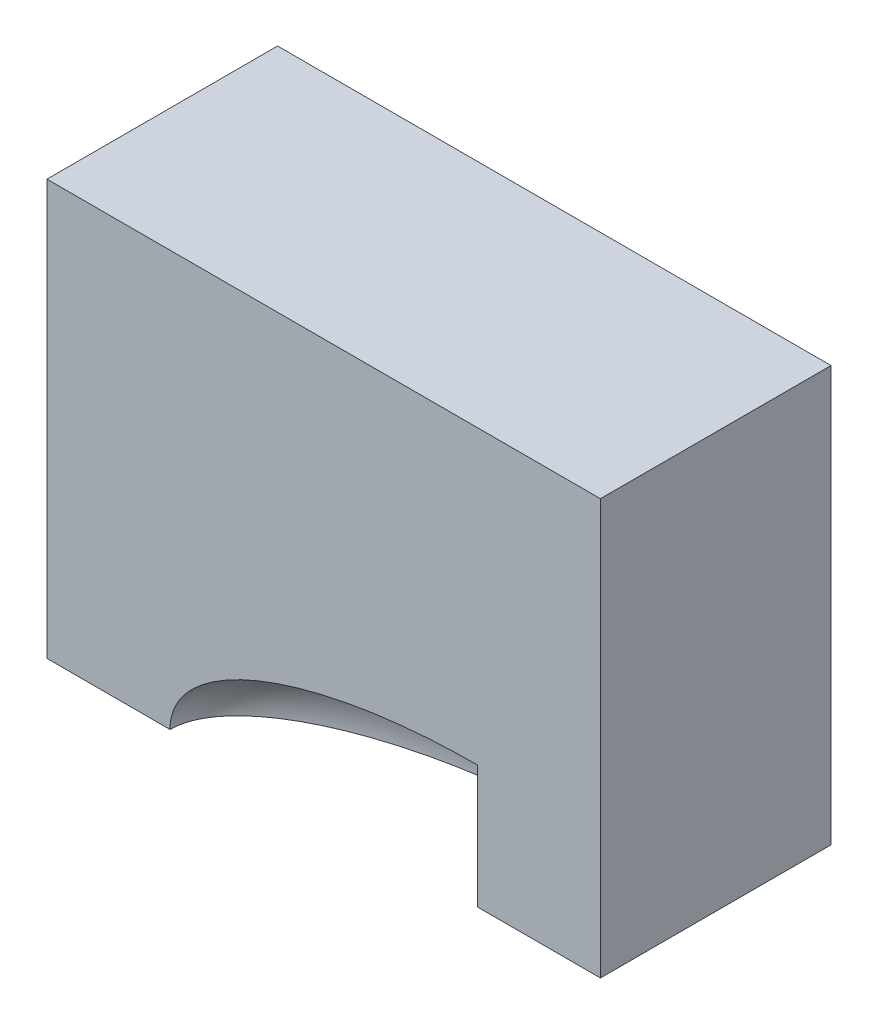
from build123d import *

# Parameters (mm, degrees)
SKETCH1_W           = 91.44
SKETCH1_H           = 68.58
BOSS_EXTRUDE1_DEPTH = 38.1


with BuildPart() as part:
    # Sketch1 → Boss-Extrude1 (new body)
    with BuildSketch(Plane.XY):
        with Locations((45.72, 34.29)):
            Rectangle(SKETCH1_W, SKETCH1_H)
    extrude(amount=BOSS_EXTRUDE1_DEPTH)

    # Sketch4 → Cut-Revolve2 (revolve, cut)
    with BuildSketch(Plane(origin=(0, 0, 0), x_dir=(-1, 0, 0), z_dir=(0, -1, 0))):
        with BuildLine():
            Line((-71.12, -38.1), (-71.12, -17.78))
            add(Edge.make_bspline(
                [(-20.32, -38.1), (-20.32, -17.78), (-71.12, -17.78)],
                knots=[3.141592654, 3.141592654, 3.141592654, 4.71238898, 4.71238898, 4.71238898], degree=2, weights=[1, 0.707106781, 1]))
            Line((-20.32, -38.1), (-71.12, -38.1))
        make_face()
    revolve(axis=Axis((71.12, 0, 38.1), (-1, 0, 0)), mode=Mode.SUBTRACT)


solid = part.part
